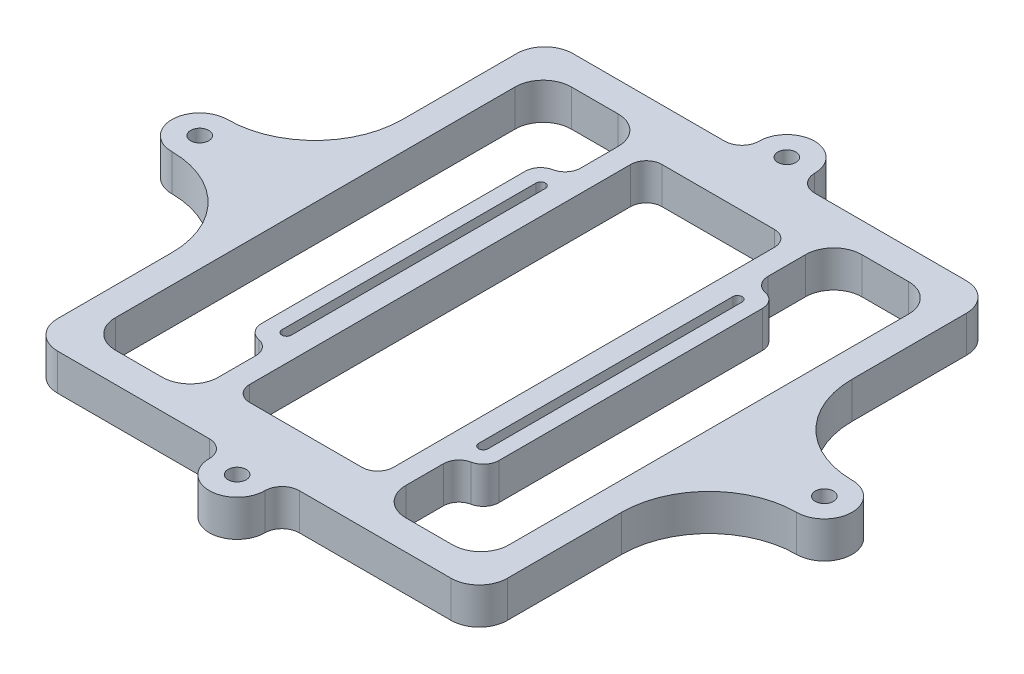
from build123d import *

# Parameters (mm, degrees)
SKETCH1_R           = 1.45
SKETCH1_W           = 23
SKETCH1_H           = 66
BOSS_EXTRUDE1_DEPTH = 5.85
FILLET1_R           = 4.5
FILLET2_R           = 0.749
FILLET3_R           = 2.5
FILLET4_R           = 2.5


with BuildPart() as part:
    # Sketch1 → Boss-Extrude1 (new body)
    # profile 1 of 4: a face of its own
    with BuildSketch(Plane(origin=(0, 0, 0), x_dir=(1, 0, 0), z_dir=(0, 1, 0))):
        with BuildLine():
            Line((-31.5, 41.25), (-7.2, 41.25))
            ThreePointArc((-7.2, 41.25), (-5.255456352, 42.055456352), (-4.45, 44))
            ThreePointArc((-4.45, 44), (0, 48.45), (4.45, 44))
            ThreePointArc((4.45, 44), (5.255456352, 42.055456352), (7.2, 41.25))
            Line((7.2, 41.25), (31.5, 41.25))
            ThreePointArc((31.5, 41.25), (34.681980515, 39.931980515), (36, 36.75))
            Line((36, 36.75), (36, 18.45))
            ThreePointArc((36, 18.45), (40.100505063, 8.550505063), (50, 4.45))
            ThreePointArc((50, 4.45), (54.45, 0), (50, -4.45))
            ThreePointArc((50, -4.45), (40.100505063, -8.550505063), (36, -18.45))
            Line((36, -18.45), (36, -36.75))
            ThreePointArc((36, -36.75), (34.681980515, -39.931980515), (31.5, -41.25))
            Line((31.5, -41.25), (7.2, -41.25))
            ThreePointArc((7.2, -41.25), (5.255456352, -42.055456352), (4.45, -44))
            ThreePointArc((4.45, -44), (0, -48.45), (-4.45, -44))
            ThreePointArc((-4.45, -44), (-5.255456352, -42.055456352), (-7.2, -41.25))
            Line((-7.2, -41.25), (-31.5, -41.25))
            ThreePointArc((-31.5, -41.25), (-34.681980515, -39.931980515), (-36, -36.75))
            Line((-36, -36.75), (-36, -18.45))
            ThreePointArc((-36, -18.45), (-40.100505063, -8.550505063), (-50, -4.45))
            ThreePointArc((-50, -4.45), (-54.45, 0), (-50, 4.45))
            ThreePointArc((-50, 4.45), (-40.100505063, 8.550505063), (-36, 18.45))
            Line((-36, 18.45), (-36, 36.75))
            ThreePointArc((-36, 36.75), (-34.681980515, 39.931980515), (-31.5, 41.25))
        make_face()
        with Locations((0, 44)):
            Circle(SKETCH1_R, mode=Mode.SUBTRACT)
        with Locations((0, -44)):
            Circle(SKETCH1_R, mode=Mode.SUBTRACT)
        with Locations((-50, 0)):
            Circle(SKETCH1_R, mode=Mode.SUBTRACT)
        with Locations((50, 0)):
            Circle(SKETCH1_R, mode=Mode.SUBTRACT)
        Polygon((31.5, 36.5), (20.5, 36.5), (-31.5, 36.5), (-31.5, -36.5), (20.5, -36.5), (31.5, -36.5), align=None, mode=Mode.SUBTRACT)
    # profile 2 of 4: a face of its own
    with BuildSketch(Plane(origin=(0, 0, 0), x_dir=(1, 0, 0), z_dir=(0, 1, 0))):
        Polygon((-15, 21.090403907), (-15, 23.590403907), (-19, 23.590403907), (-19, 0), (-19, -23.590403907), (-15, -23.590403907), (-15, -21.090403907), (-16.5, -21.090403907), (-16.5, 0), (-16.5, 21.090403907), align=None)
    # profile 3 of 4: a face of its own
    with BuildSketch(Plane(origin=(0, 0, 0), x_dir=(1, 0, 0), z_dir=(0, 1, 0))):
        Polygon((19, 23.590403907), (15, 23.590403907), (15, 21.090403907), (16.5, 21.090403907), (16.5, 0), (16.5, -21.090403907), (15, -21.090403907), (15, -23.590403907), (19, -23.590403907), (19, 0), align=None)
    # profile 4 of 4: a face of its own
    with BuildSketch(Plane(origin=(0, 0, 0), x_dir=(1, 0, 0), z_dir=(0, 1, 0))):
        Polygon((15, 36.5), (-15, 36.5), (-15, 23.590403907), (-15, 21.090403907), (-15, -21.090403907), (-15, -23.590403907), (-15, -36.5), (15, -36.5), (15, -23.590403907), (15, -21.090403907), (15, 21.090403907), (15, 23.590403907), align=None)
        Rectangle(SKETCH1_W, SKETCH1_H, mode=Mode.SUBTRACT)
    extrude(amount=BOSS_EXTRUDE1_DEPTH)

    # Fillet1
    fillet1_edges = [part.edges().sort_by_distance(p)[0] for p in [
        (15, 2.925, 36.5),
        (31.5, 2.925, 36.5),
        (-15, 2.925, 36.5),
        (31.5, 2.925, -36.5),
        (-15, 2.925, -36.5),
        (15, 2.925, -36.5),
        (-31.5, 2.925, -36.5),
        (-31.5, 2.925, 36.5),
    ]]
    fillet(fillet1_edges, radius=FILLET1_R)

    # Fillet2
    fillet2_edges = [part.edges().sort_by_distance(p)[0] for p in [
        (16.5, 2.925, 21.090403907),
        (15, 2.925, 21.090403907),
        (-15, 2.925, 21.090403907),
        (-16.5, 2.925, 21.090403907),
        (16.5, 2.925, -21.090403907),
        (15, 2.925, -21.090403907),
        (-15, 2.925, -21.090403907),
        (-16.5, 2.925, -21.090403907),
    ]]
    fillet(fillet2_edges, radius=FILLET2_R)

    # Fillet3
    fillet3_edges = [part.edges().sort_by_distance(p)[0] for p in [
        (-19, 2.925, -23.590403907),
        (19, 2.925, -23.590403907),
        (19, 2.925, 23.590403907),
        (-19, 2.925, 23.590403907),
        (11.5, 2.925, 33),
        (-11.5, 2.925, 33),
        (11.5, 2.925, -33),
        (-11.5, 2.925, -33),
    ]]
    fillet(fillet3_edges, radius=FILLET3_R)

    # Fillet4
    fillet4_edges = [part.edges().sort_by_distance(p)[0] for p in [
        (15, 2.925, -23.590403907),
        (-15, 2.925, -23.590403907),
        (15, 2.925, 23.590403907),
        (-15, 2.925, 23.590403907),
    ]]
    fillet(fillet4_edges, radius=FILLET4_R)


solid = part.part
